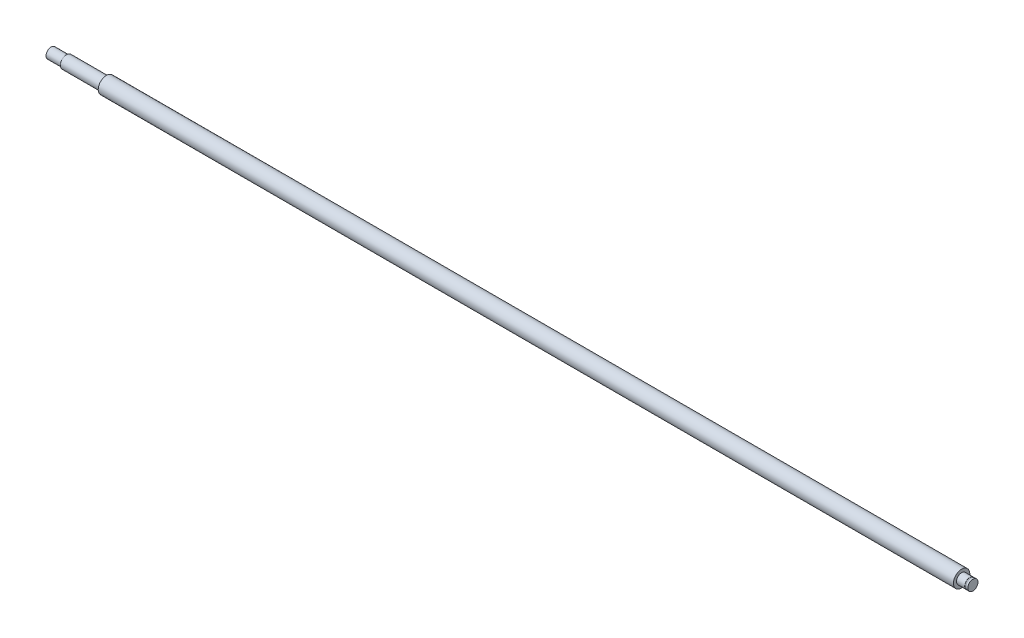
from build123d import *


with BuildPart() as part:
    # Sketch2 → Revolve1 (revolve)
    with BuildSketch(Plane.XY, mode=Mode.PRIVATE) as revolve1_sk:
        Polygon((0, 0), (0, 5), (15, 5), (15, 6), (54, 6), (54, 8), (889, 8), (889, 5), (897, 5), (897, 4.8), (898.15, 4.8), (898.15, 5), (900, 5), (900, 0), align=None)
    revolve(revolve1_sk.sketch.rotate(Axis((0, 0, 0), (1, 0, 0)), 90), axis=Axis((0, 0, 0), (1, 0, 0)))


solid = part.part
